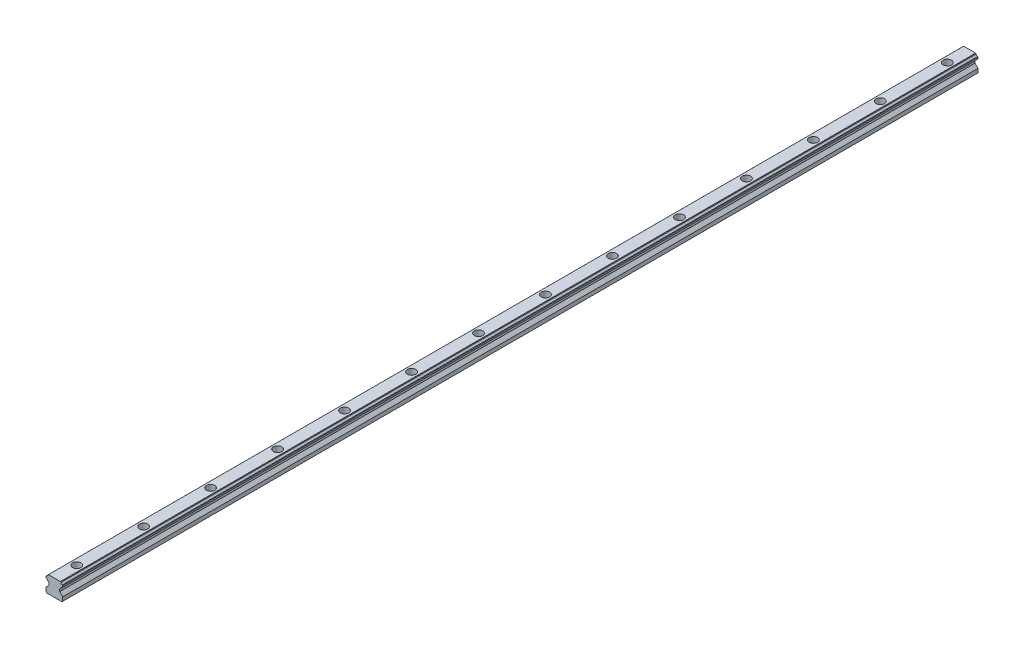
from build123d import *

# Parameters (mm, degrees)
EXTRUDE1_DEPTH  = 820
LPATTERN1_COUNT = 14
LPATTERN1_PITCH = 60


with BuildPart() as part:
    # Sketch1 → Extrude1 (new body)
    with BuildSketch(Plane(origin=(-20, 0, 0), x_dir=(1, 0, 0), z_dir=(0, 0, 1))):
        with BuildLine():
            Line((12.5, 0.69999271), (13.199992786, 0))
            Line((13.199992786, 0), (26.800007214, 0))
            Line((26.800007214, 0), (27.5, 0.69999271))
            Line((27.5, 0.69999271), (27.5, 4.2000246))
            Line((27.5, 4.2000246), (24.8000183, 6.9000063))
            Line((24.8000183, 6.9000063), (24.8000183, 8.8400054))
            Line((24.8000183, 8.8400054), (25.755946813, 9.794179118))
            ThreePointArc((25.755946813, 9.794179118), (26.198484624, 10.690600567), (27.09432569, 11.13431209))
            Line((27.09432569, 11.13431209), (27.5, 11.5399866))
            Line((27.5, 11.5399866), (27.5, 12.8500204))
            Line((27.5, 12.8500204), (27.09432569, 13.268442751))
            ThreePointArc((27.09432569, 13.268442751), (26.202460867, 13.706434947), (25.755946813, 14.594063938))
            Line((25.755946813, 14.594063938), (25.3500197, 15))
            Line((25.3500197, 15), (14.6499803, 15))
            Line((14.6499803, 15), (14.244053187, 14.594063938))
            ThreePointArc((14.244053187, 14.594063938), (13.797539133, 13.706434947), (12.90567431, 13.268442751))
            Line((12.90567431, 13.268442751), (12.5, 12.8500204))
            Line((12.5, 12.8500204), (12.5, 11.5399866))
            Line((12.5, 11.5399866), (12.90567431, 11.13431209))
            ThreePointArc((12.90567431, 11.13431209), (13.801515376, 10.690600567), (14.244053187, 9.794179118))
            Line((14.244053187, 9.794179118), (15.1999817, 8.8400054))
            Line((15.1999817, 8.8400054), (15.1999817, 6.9000063))
            Line((15.1999817, 6.9000063), (12.5, 4.2000246))
            Line((12.5, 4.2000246), (12.5, 0.69999271))
        make_face()
    extrude(amount=-EXTRUDE1_DEPTH)

    # Sketch2 → Cut-Revolve1 (revolve, cut)
    with BuildSketch(Plane(origin=(0, 0, 0), x_dir=(0, 0, -1), z_dir=(1, 0, 0))):
        Polygon((20, 15), (23.75, 15), (23.75, 9.7), (22.25, 9.7), (22.25, 0), (20, 0), align=None)
    cut_revolve1 = revolve(axis=Axis((0, 0, -20), (0, 1, 0)), mode=Mode.SUBTRACT)

    # LPattern1: Cut-Revolve1 ×14
    with Locations(*[(0, 0, -i * LPATTERN1_PITCH) for i in range(1, LPATTERN1_COUNT)]):
        add(cut_revolve1, mode=Mode.SUBTRACT)


solid = part.part
